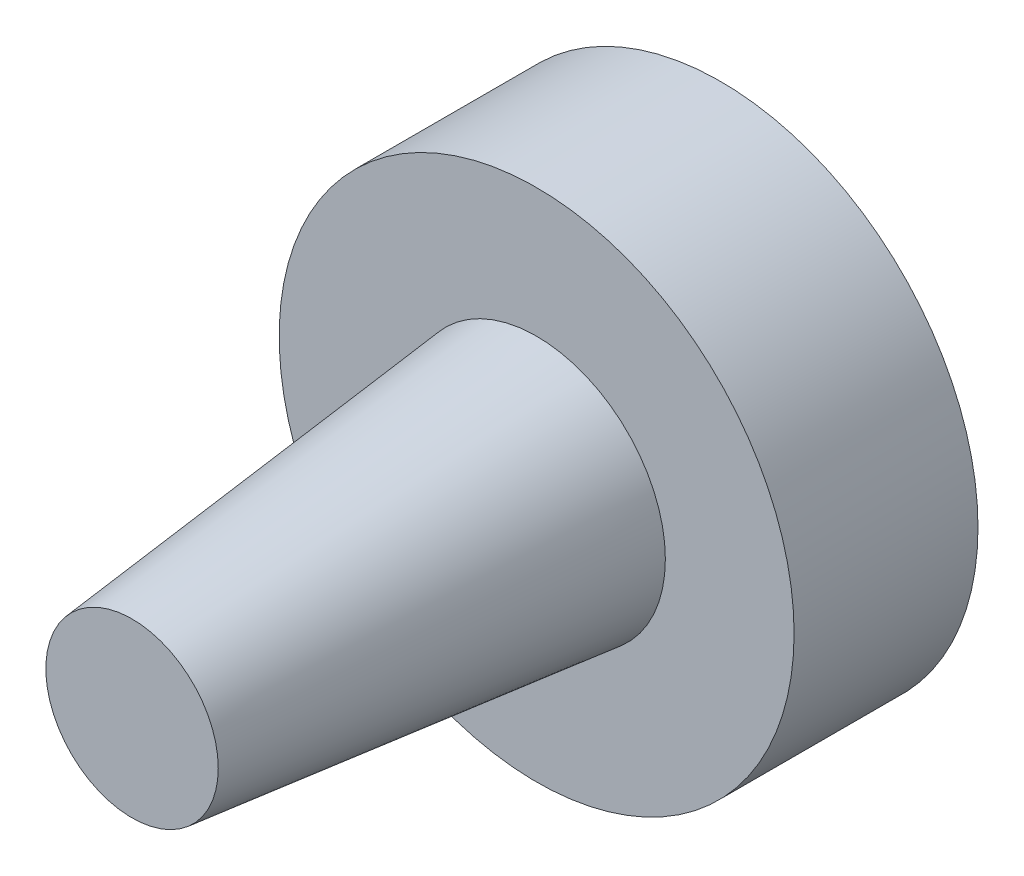
from build123d import *

# Parameters (mm, degrees)
SKETCH1_R           = 7
BOSS_EXTRUDE1_DEPTH = 5
SKETCH2_R           = 3.5
BOSS_EXTRUDE2_DEPTH = 11
BOSS_EXTRUDE2_TAPER = 6


with BuildPart() as part:
    # Sketch1 → Boss-Extrude1 (new body)
    with BuildSketch(Plane.XY):
        Circle(SKETCH1_R)
    extrude(amount=BOSS_EXTRUDE1_DEPTH)

    # Sketch2 → Boss-Extrude2 (add)
    with BuildSketch(Plane.XY.offset(5)):
        Circle(SKETCH2_R)
    extrude(amount=BOSS_EXTRUDE2_DEPTH, taper=BOSS_EXTRUDE2_TAPER)


solid = part.part
